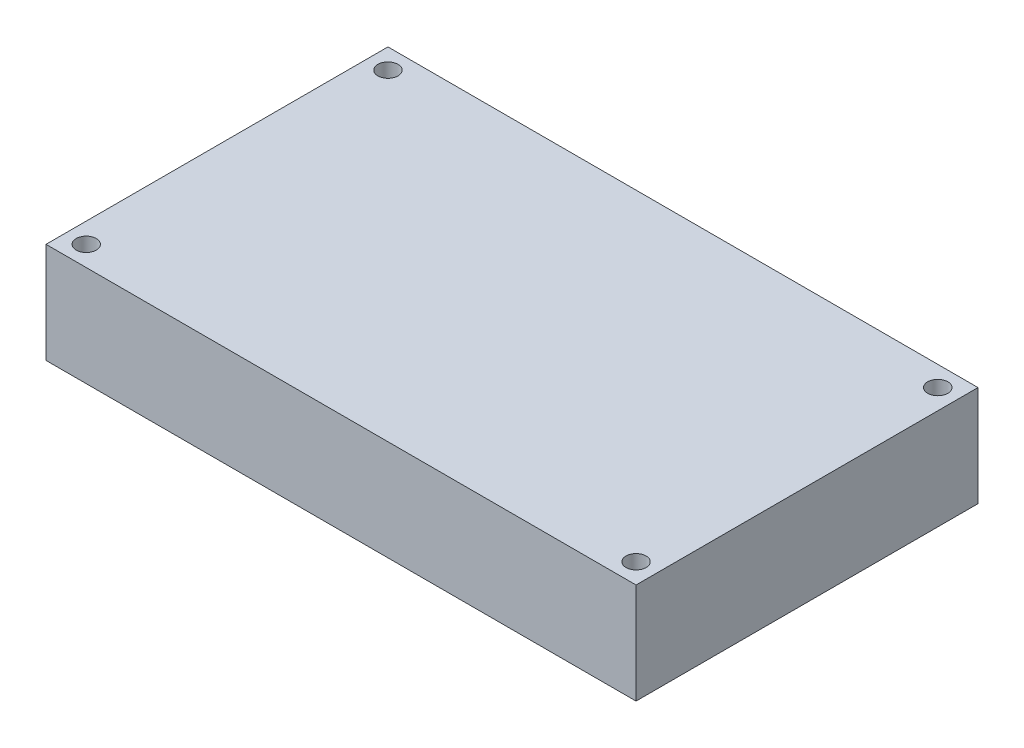
from build123d import *

# Parameters (mm, degrees)
CROQUIS1_W              = 88
CROQUIS1_H              = 51
SALIENTE_EXTRUIR1_DEPTH = 15
CROQUIS3_R              = 1.5
CORTAR_EXTRUIR1_DEPTH   = 54.021222166


with BuildPart() as part:
    # Croquis1 → Saliente-Extruir1 (new body)
    with BuildSketch(Plane(origin=(0, 0, 0), x_dir=(1, 0, 0), z_dir=(0, 1, 0))):
        Rectangle(CROQUIS1_W, CROQUIS1_H)
    extrude(amount=SALIENTE_EXTRUIR1_DEPTH)

    # Croquis3 → Cortar-Extruir1 (cut, through all)
    with BuildSketch(Plane.XZ):
        with Locations(Location((-41, 22.5, 0), (0, 0, 270))):
            Circle(CROQUIS3_R)
        with Locations(Location((41, 22.5, 0), (0, 0, 270))):
            Circle(CROQUIS3_R)
        with Locations(Location((41, -22.5, 0), (0, 0, 270))):
            Circle(CROQUIS3_R)
        with Locations(Location((-41, -22.5, 0), (0, 0, 270))):
            Circle(CROQUIS3_R)
    extrude(amount=-CORTAR_EXTRUIR1_DEPTH, mode=Mode.SUBTRACT)


solid = part.part
